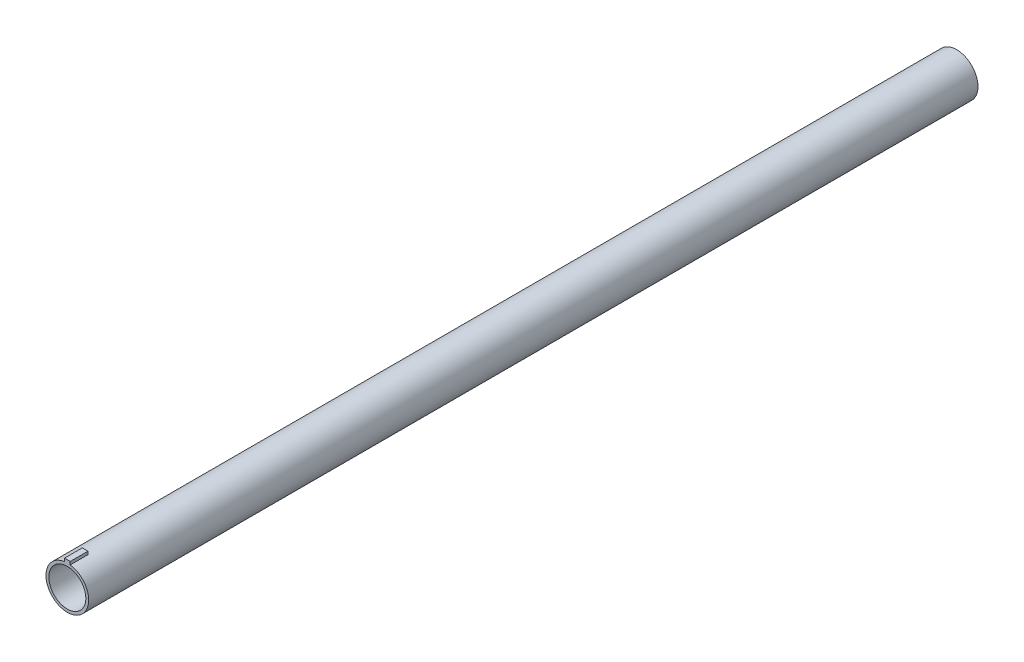
from build123d import *

# Parameters (mm, degrees)
SKETCH1_R           = 30
SKETCH1_R_2         = 26
BOSS_EXTRUDE1_DEPTH = 1250
SKETCH2_R           = 15
CUT_EXTRUDE1_DEPTH  = 30
BOSS_EXTRUDE2_START = -25
BOSS_EXTRUDE2_DEPTH = 25


with BuildPart() as part:
    # Sketch1 → Boss-Extrude1 (new body)
    with BuildSketch(Plane.XY):
        Circle(SKETCH1_R)
        Circle(SKETCH1_R_2, mode=Mode.SUBTRACT)
    extrude(amount=BOSS_EXTRUDE1_DEPTH)

    # Sketch2 → Cut-Extrude1 (cut)
    with BuildSketch(Plane(origin=(0, 0, 0), x_dir=(1, 0, 0), z_dir=(0, 1, 0))):
        with Locations(Location((0, -1175, 0), (0, 0, 270))):
            Circle(SKETCH2_R)
        with Locations(Location((0, -1075, 0), (0, 0, 270))):
            Circle(SKETCH2_R)
        with Locations(Location((0, -975, 0), (0, 0, 270))):
            Circle(SKETCH2_R)
        with Locations(Location((0, -875, 0), (0, 0, 270))):
            Circle(SKETCH2_R)
        with Locations(Location((0, -775, 0), (0, 0, 270))):
            Circle(SKETCH2_R)
        with Locations(Location((0, -675, 0), (0, 0, 270))):
            Circle(SKETCH2_R)
        with Locations(Location((0, -575, 0), (0, 0, 270))):
            Circle(SKETCH2_R)
        with Locations(Location((0, -475, 0), (0, 0, 270))):
            Circle(SKETCH2_R)
        with Locations(Location((0, -375, 0), (0, 0, 270))):
            Circle(SKETCH2_R)
        with Locations(Location((0, -275, 0), (0, 0, 270))):
            Circle(SKETCH2_R)
        with Locations(Location((0, -175, 0), (0, 0, 270))):
            Circle(SKETCH2_R)
        with Locations(Location((0, -75, 0), (0, 0, 270))):
            Circle(SKETCH2_R)
    extrude(amount=-CUT_EXTRUDE1_DEPTH, mode=Mode.SUBTRACT)

    # Sketch3 → Boss-Extrude2 (add)
    with BuildSketch(Plane.XY.offset(1250).offset(BOSS_EXTRUDE2_START)):
        with BuildLine():
            Line((0, 34), (0, 30))
            ThreePointArc((0, 30), (2.004479379, 29.932959466), (4, 29.732137495))
            Line((4, 29.732137495), (4, 34))
            Line((4, 34), (0, 34))
        make_face()
        with BuildLine():
            ThreePointArc((-4, 29.732137495), (-2.004479379, 29.932959466), (0, 30))
            Line((0, 30), (0, 34))
            Line((0, 34), (-4, 34))
            Line((-4, 34), (-4, 29.732137495))
        make_face()
        with BuildLine():
            Line((-4, 26), (0, 26))
            Line((0, 26), (0, 30))
            ThreePointArc((0, 30), (-2.004479379, 29.932959466), (-4, 29.732137495))
            Line((-4, 29.732137495), (-4, 26))
        make_face()
        with BuildLine():
            Line((0, 30), (0, 26))
            Line((0, 26), (4, 26))
            Line((4, 26), (4, 29.732137495))
            ThreePointArc((4, 29.732137495), (2.004479379, 29.932959466), (0, 30))
        make_face()
    extrude(amount=BOSS_EXTRUDE2_DEPTH)


solid = part.part
